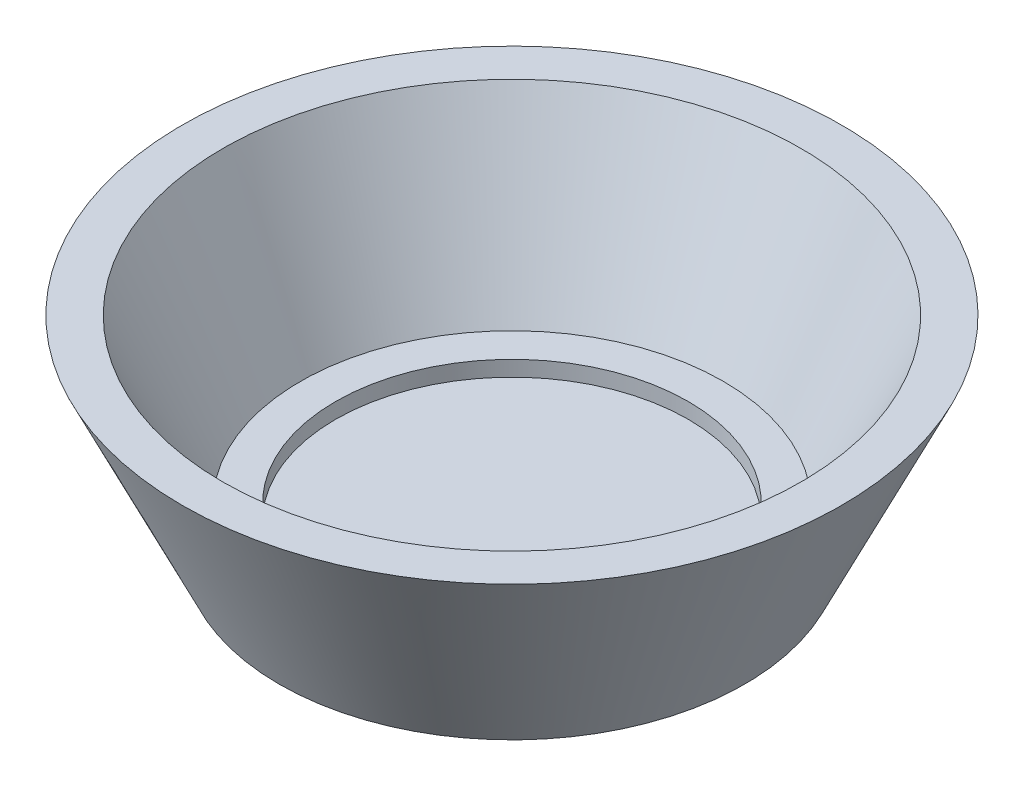
from build123d import *

# Parameters (mm, degrees)
SKETCH2_R          = 57.049339495
CUT_EXTRUDE1_DEPTH = 5


with BuildPart() as part:
    # Sketch1 → Revolve1 (revolve)
    with BuildSketch(Plane.XY, mode=Mode.PRIVATE) as revolve1_sk:
        Polygon((0, 0), (75.266699621, 0), (106.605503378, 65.757917285), (93.480705223, 65.757917285), (68.367246776, 13.062583534), (0, 13.062583534), align=None)
    revolve(revolve1_sk.sketch.rotate(Axis((0, 73.257801944, 0), (0, -1, 0)), 90), axis=Axis((0, 73.257801944, 0), (0, -1, 0)))

    # Sketch2 → Cut-Extrude1 (cut)
    with BuildSketch(Plane(origin=(0, 13.062583534, 0), x_dir=(1, 0, 0), z_dir=(0, 1, 0))):
        with Locations(Location((0, 0, 0), (0, 0, 270))):
            Circle(SKETCH2_R)
    extrude(amount=-CUT_EXTRUDE1_DEPTH, mode=Mode.SUBTRACT)


solid = part.part
